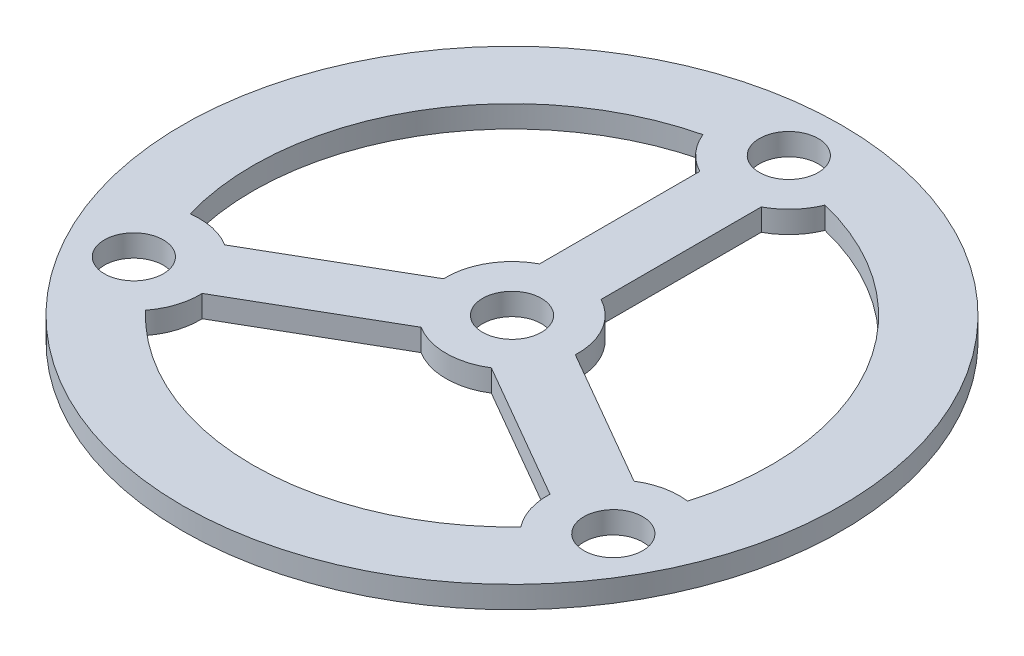
from build123d import *
from build123d.topology import SkipClean

# Parameters (mm, degrees)
SKETCH1_R           = 37.5
SKETCH1_R_2         = 3.35
BOSS_EXTRUDE1_DEPTH = 2.5
BOSS_EXTRUDE2_DEPTH = 2.5


with BuildPart() as part:
    # Sketch1 → Boss-Extrude1 (new body)
    with BuildSketch(Plane(origin=(0, 0, 0), x_dir=(1, 0, 0), z_dir=(0, 1, 0))):
        with Locations(Location((0, 0, 0), (0, 0, 270))):
            Circle(SKETCH1_R)
        with Locations(Location((0, 31.5, 0), (0, 0, 270))):
            Circle(SKETCH1_R_2, mode=Mode.SUBTRACT)
        with Locations(Location((27.279800219, -15.75, 0), (0, 0, 270))):
            Circle(SKETCH1_R_2, mode=Mode.SUBTRACT)
        with Locations(Location((-27.279800219, -15.75, 0), (0, 0, 270))):
            Circle(SKETCH1_R_2, mode=Mode.SUBTRACT)
        with BuildLine():
            ThreePointArc((-6.945839996, 28.670634921), (-25.547749412, 14.75), (-28.302418182, -8.320043573))
            ThreePointArc((-28.302418182, -8.320043573), (-20.784609691, -12), (-21.356578186, -20.350591347))
            ThreePointArc((-21.356578186, -20.350591347), (0, -29.5), (21.356578186, -20.350591347))
            ThreePointArc((21.356578186, -20.350591347), (20.784609691, -12), (28.302418182, -8.320043573))
            ThreePointArc((28.302418182, -8.320043573), (25.547749412, 14.75), (6.945839996, 28.670634921))
            ThreePointArc((6.945839996, 28.670634921), (0, 24), (-6.945839996, 28.670634921))
        make_face(mode=Mode.SUBTRACT)
    extrude(amount=BOSS_EXTRUDE1_DEPTH)

    # Sketch2 → Boss-Extrude2 (add)
    with SkipClean():  # the faces are left unmerged after this step: merging them gives an invalid solid
        with BuildSketch(Plane(origin=(0, 0, 0), x_dir=(1, 0, 0), z_dir=(0, 1, 0))):
            with BuildLine():
                Line((-3.5, 31.5), (-3.5, 6.633249581))
                ThreePointArc((-3.5, 6.633249581), (-6.495190528, 3.75), (-7.494562647, -0.285535877))
                Line((-7.494562647, -0.285535877), (-29.029800219, -12.718911087))
                Line((-29.029800219, -12.718911087), (-28.954800219, -12.848814897))
                ThreePointArc((-28.954800219, -12.848814897), (-24.378615117, -14.075), (-25.604800219, -18.651185103))
                Line((-25.604800219, -18.651185103), (-25.529800219, -18.781088913))
                Line((-25.529800219, -18.781088913), (-3.994562647, -6.347713704))
                ThreePointArc((-3.994562647, -6.347713704), (0, -7.5), (3.994562647, -6.347713704))
                Line((3.994562647, -6.347713704), (25.529800219, -18.781088913))
                Line((25.529800219, -18.781088913), (25.604800219, -18.651185103))
                ThreePointArc((25.604800219, -18.651185103), (24.378615117, -14.075), (28.954800219, -12.848814897))
                Line((28.954800219, -12.848814897), (29.029800219, -12.718911087))
                Line((29.029800219, -12.718911087), (7.494562647, -0.285535877))
                ThreePointArc((7.494562647, -0.285535877), (6.495190528, 3.75), (3.5, 6.633249581))
                Line((3.5, 6.633249581), (3.5, 31.5))
                Line((3.5, 31.5), (3.35, 31.5))
                ThreePointArc((3.35, 31.5), (0, 28.15), (-3.35, 31.5))
                Line((-3.35, 31.5), (-3.5, 31.5))
            make_face()
            with BuildLine():
                ThreePointArc((-1.675, 2.901185103), (2.901185103, 1.675), (1.675, -2.901185103))
                ThreePointArc((1.675, -2.901185103), (-2.901185103, -1.675), (-1.675, 2.901185103))
            make_face(mode=Mode.SUBTRACT)
        extrude(amount=BOSS_EXTRUDE2_DEPTH)


solid = part.part
